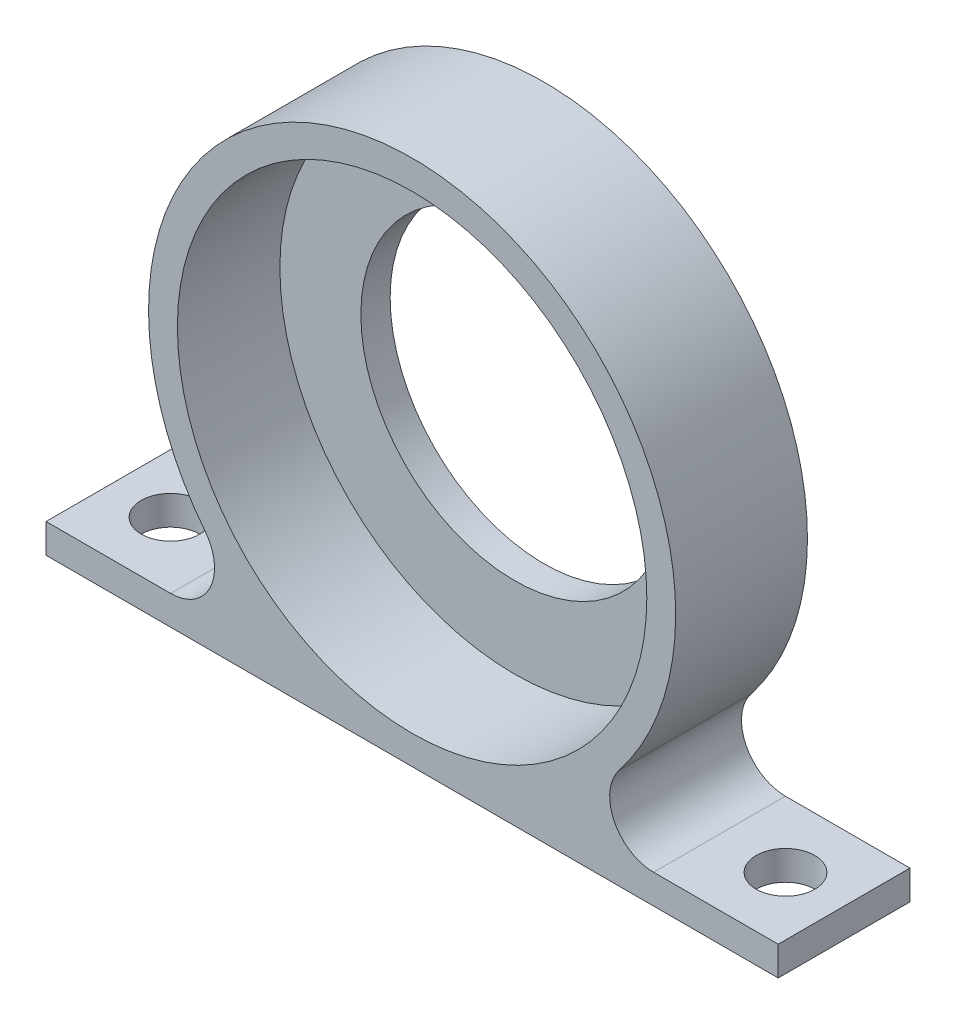
from build123d import *

# Parameters (mm, degrees)
CROQUIS1_R              = 16.03
SALIENTE_EXTRUIR1_DEPTH = 9
CROQUIS2_R              = 10.5
SALIENTE_EXTRUIR2_DEPTH = 2
REDONDEO1_R             = 3
CROQUIS3_R              = 2
CORTAR_EXTRUIR1_DEPTH   = 44.150898021


with BuildPart() as part:
    # Croquis1 → Saliente-Extruir1 (new body)
    with BuildSketch(Plane.XY):
        with BuildLine():
            Line((-8.246211251, -16), (-25, -16))
            Line((-25, -16), (-25, -18))
            Line((-25, -18), (25, -18))
            Line((25, -18), (25, -16))
            Line((25, -16), (8.246211251, -16))
            ThreePointArc((8.246211251, -16), (0, 18), (-8.246211251, -16))
        make_face()
        Circle(CROQUIS1_R, mode=Mode.SUBTRACT)
    extrude(amount=SALIENTE_EXTRUIR1_DEPTH)

    # Croquis2 → Saliente-Extruir2 (add)
    with BuildSketch(Plane(origin=(0, 0, 0), x_dir=(-1, 0, 0), z_dir=(0, 0, -1))):
        with BuildLine():
            Line((-8.246211251, -16), (-25, -16))
            Line((-25, -16), (-25, -18))
            Line((-25, -18), (25, -18))
            Line((25, -18), (25, -16))
            Line((25, -16), (8.246211251, -16))
            ThreePointArc((8.246211251, -16), (0, 18), (-8.246211251, -16))
        make_face()
        Circle(CROQUIS2_R, mode=Mode.SUBTRACT)
    extrude(amount=-SALIENTE_EXTRUIR2_DEPTH)

    # Redondeo1
    redondeo1_edges = [part.edges().sort_by_distance(p)[0] for p in [
        (8.246211251, -16, 4.5),
        (-8.246211251, -16, 4.5),
    ]]
    fillet(redondeo1_edges, radius=REDONDEO1_R)

    # Croquis3 → Cortar-Extruir1 (cut, through all)
    with BuildSketch(Plane(origin=(0, -16, 0), x_dir=(1, 0, 0), z_dir=(0, 1, 0))):
        with Locations(Location((-21, -4.5, 0), (0, 0, 270))):
            Circle(CROQUIS3_R)
        with Locations(Location((21, -4.5, 0), (0, 0, 270))):
            Circle(CROQUIS3_R)
    extrude(amount=-CORTAR_EXTRUIR1_DEPTH, mode=Mode.SUBTRACT)


solid = part.part
